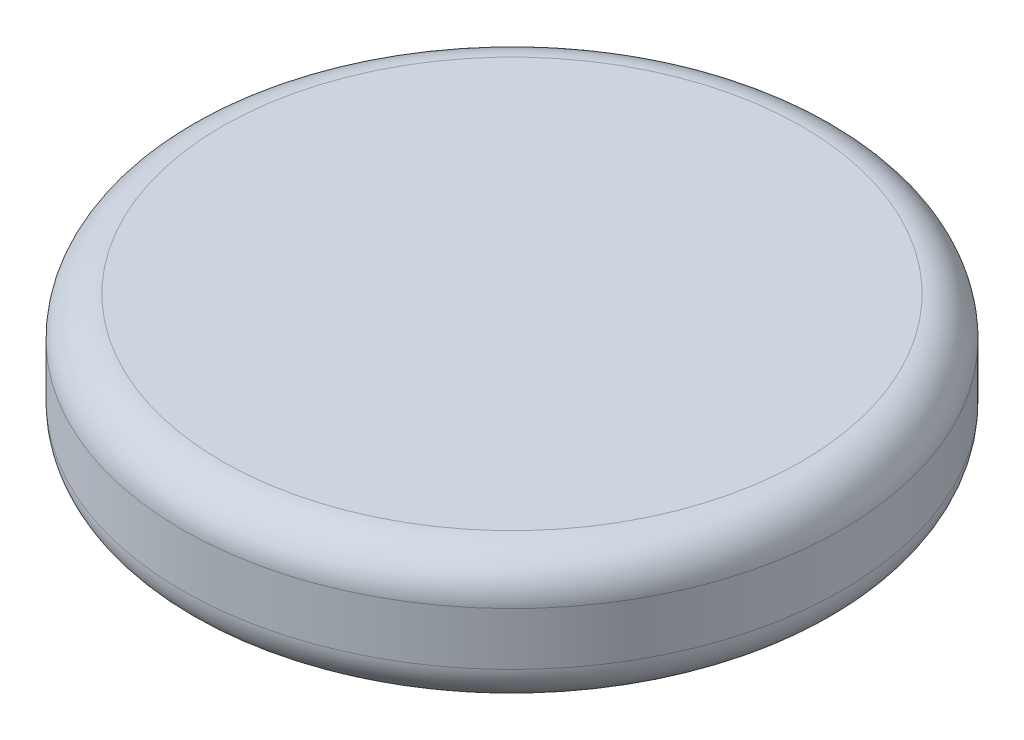
from build123d import *

# Parameters (mm, degrees)
SKETCH2_R           = 25
BOSS_EXTRUDE1_DEPTH = 10
FILLET1_R           = 3
SKETCH3_W           = 28.25
SKETCH3_H           = 28.25
BOSS_EXTRUDE2_DEPTH = 1


with BuildPart() as part:
    # Sketch2 → Boss-Extrude1 (new body)
    with BuildSketch(Plane(origin=(0, 0, 0), x_dir=(1, 0, 0), z_dir=(0, 1, 0))):
        with Locations(Location((0, 0, 0), (0, 0, 270))):
            Circle(SKETCH2_R)
    extrude(amount=BOSS_EXTRUDE1_DEPTH)

    # Fillet1
    fillet1_edges = [part.edges().sort_by_distance(p)[0] for p in [
        (0, 0, -25),
        (0, 10, -25),
    ]]
    fillet(fillet1_edges, radius=FILLET1_R)

    # Sketch3 → Boss-Extrude2 (add)
    with BuildSketch(Plane(origin=(0, 0, 0), x_dir=(-1, 0, 0), z_dir=(0, -1, 0))):
        Rectangle(SKETCH3_W, SKETCH3_H)
    extrude(amount=BOSS_EXTRUDE2_DEPTH)


solid = part.part
